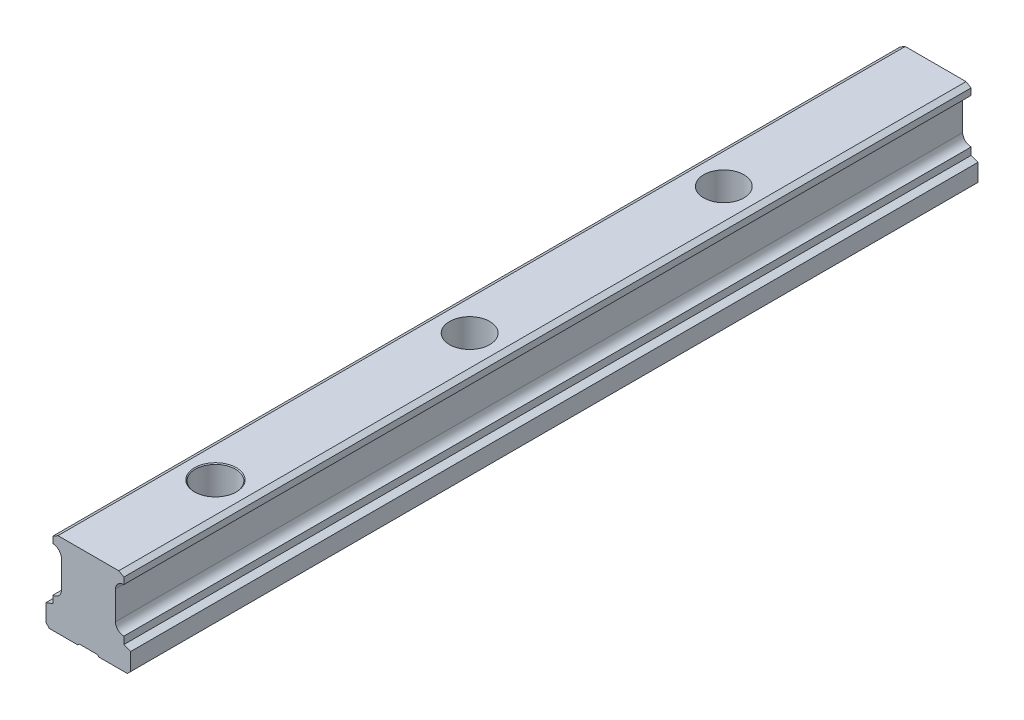
from build123d import *

# Parameters (mm, degrees)
BOSS_EXTRU_1_DEPTH      = 1980
ENL_V_MAT_EXTRU_1_DEPTH = 1981.194091497
ESQUISSE3_W             = 4.3
ESQUISSE3_H             = 0.35
ENL_V_MAT_EXTRU_2_DEPTH = 1980
ESQUISSE4_W             = 1.625
ESQUISSE4_H             = 14.5
ENL_V_MAT_EXTRU_3_DEPTH = 1981.194091497
ENL_V_MAT_EXTRU_4_DEPTH = 1981.194091497
D_POUILLE1_ANGLE        = 20
D_POUILLE2_ANGLE        = 20
D_POUILLE3_ANGLE        = 45
PER_AGE1_D              = 6
PER_AGE1_DEPTH          = 20
PER_AGE1_CBORE_D        = 9.5
PER_AGE1_CBORE_DEPTH    = 8.5
CHANFREIN1_SIZE         = 0.8
CHANFREIN2_SIZE         = 1.2
CHANFREIN2_SIZE2        = 0.692820323
CHANFREIN3_SIZE         = 0.2
CHANFREIN4_SIZE         = 0.692820323
CHANFREIN4_SIZE2        = 1.2
ENL_V_START             = -200
ESQUISSE12_W            = 78.153878041
ESQUISSE12_H            = 74.514600195
ENL_V_MAT_EXTRU_5_DEPTH = 1781.194091497


with BuildPart() as part:
    # Esquisse1 → Boss.-Extru.1 (new body)
    with BuildSketch(Plane(origin=(0, 0, 0), x_dir=(-1, 0, 0), z_dir=(0, 0, -1))):
        with BuildLine():
            Line((-19.2, 7.973691854), (-19.2, 0))
            Line((-19.2, 0), (0.8, 0))
            Line((0.8, 0), (0.8, 20))
            Line((0.8, 20), (-17.575, 20))
            Line((-17.575, 20), (-17.575, 17.767136655))
            ThreePointArc((-17.575, 17.767136655), (-16.197491801, 17.200016465), (-15.5625262, 15.852436102))
            Line((-15.5625262, 15.852436102), (-15.5625262, 9.147563898))
            ThreePointArc((-15.5625262, 9.147563898), (-16.984759825, 7.331984363), (-19.2, 7.973691854))
        make_face()
    extrude(amount=-BOSS_EXTRU_1_DEPTH)

    # Esquisse2 → Enlèv. mat.-Extru.1 (cut, through all)
    with BuildSketch(Plane.XY.offset(1980)):
        with BuildLine():
            Line((17.575, 7.232863345), (17.575, 4.908548369))
            Line((17.575, 4.908548369), (19.2, 4.908548369))
            Line((19.2, 4.908548369), (19.2, 7.973691854))
            ThreePointArc((19.2, 7.973691854), (18.471955551, 7.418025184), (17.575, 7.232863345))
        make_face()
    extrude(amount=-ENL_V_MAT_EXTRU_1_DEPTH, mode=Mode.SUBTRACT)

    # Esquisse3 → Enlèv. mat.-Extru.2 (cut)
    with BuildSketch(Plane.XY.offset(1980)):
        with Locations((9.2, 0.175)):
            Rectangle(ESQUISSE3_W, ESQUISSE3_H)
    extrude(amount=-ENL_V_MAT_EXTRU_2_DEPTH, mode=Mode.SUBTRACT)

    # Esquisse4 → Enlèv. mat.-Extru.3 (cut, through all)
    with BuildSketch(Plane.XY.offset(1980)):
        with Locations((0.0125, 12.75)):
            Rectangle(ESQUISSE4_W, ESQUISSE4_H)
    extrude(amount=-ENL_V_MAT_EXTRU_3_DEPTH, mode=Mode.SUBTRACT)

    # Esquisse5 → Enlèv. mat.-Extru.4 (cut, through all)
    with BuildSketch(Plane.XY.offset(1980)):
        with BuildLine():
            Line((0.825, 17.767136655), (0.825, 7.232863345))
            ThreePointArc((0.825, 7.232863345), (2.202508199, 7.799983535), (2.8374738, 9.147563898))
            Line((2.8374738, 9.147563898), (2.8374738, 15.852436102))
            ThreePointArc((2.8374738, 15.852436102), (2.202508199, 17.200016465), (0.825, 17.767136655))
        make_face()
    extrude(amount=-ENL_V_MAT_EXTRU_4_DEPTH, mode=Mode.SUBTRACT)

    # Dépouille1
    d_pouille1_faces = [part.faces().sort_by_distance(p)[0] for p in [
        (0.0125, 5.5, 990),
    ]]
    draft(d_pouille1_faces, Plane(origin=(0.825, 5.5, 0), x_dir=(0, -1, 0), z_dir=(-1, 0, 0)), D_POUILLE1_ANGLE)

    # Dépouille2
    d_pouille2_faces = [part.faces().sort_by_distance(p)[0] for p in [
        (18.3875, 4.908548369, 990),
    ]]
    draft(d_pouille2_faces, Plane(origin=(19.2, 7.973691854, 1980), x_dir=(0, 0, 1), z_dir=(1, 0, 0)), D_POUILLE2_ANGLE)

    # Dépouille3
    d_pouille3_faces = [part.faces().sort_by_distance(p)[0] for p in [
        (11.35, 0.175, 990),
        (7.05, 0.175, 990),
    ]]
    draft(d_pouille3_faces, Plane(origin=(11.35, 0.35, 0), x_dir=(0, 0, -1), z_dir=(0, -1, 0)), D_POUILLE3_ANGLE)

    # Perçage1
    with Locations(Plane(origin=(0, 20, 0), x_dir=(1, 0, 0), z_dir=(0, 1, 0))):
        with Locations((9.2, -30), (9.2, -90), (9.2, -150), (9.2, -210), (9.2, -270), (9.2, -330), (9.2, -390), (9.2, -450), (9.2, -510), (9.2, -570), (9.2, -630), (9.2, -690), (9.2, -750), (9.2, -810), (9.2, -870), (9.2, -930), (9.2, -990), (9.2, -1050), (9.2, -1110), (9.2, -1170), (9.2, -1230), (9.2, -1290), (9.2, -1350), (9.2, -1410), (9.2, -1470), (9.2, -1530), (9.2, -1590), (9.2, -1650), (9.2, -1710), (9.2, -1770), (9.2, -1830), (9.2, -1890), (9.2, -1950)):
            CounterBoreHole(PER_AGE1_D / 2, PER_AGE1_CBORE_D / 2, PER_AGE1_CBORE_DEPTH, depth=PER_AGE1_DEPTH)

    # Chanfrein1
    chanfrein1_edges = [part.edges().sort_by_distance(p)[0] for p in [
        (-0.8, 0, 990),
        (19.2, 0, 990),
    ]]
    chamfer(chanfrein1_edges, length=CHANFREIN1_SIZE)

    # Chanfrein2
    chanfrein2_edges = [part.edges().sort_by_distance(p)[0] for p in [
        (0.825, 20, 990),
    ]]
    chanfrein2_side = [part.faces().sort_by_distance(p)[0] for p in [
        (9.2, 20, 19.800708478),
    ]]
    chamfer(chanfrein2_edges, length=CHANFREIN2_SIZE, length2=CHANFREIN2_SIZE2, reference=chanfrein2_side[0])

    # Chanfrein3
    chanfrein3_edges = [part.edges().sort_by_distance(p)[0] for p in [
        (12.2, 0, 1950),
        (6.327718677, 0, 1949.133974596),
        (4.45, 20, 1950),
    ]]
    chamfer(chanfrein3_edges, length=CHANFREIN3_SIZE)

    # Chanfrein4
    chanfrein4_edges = [part.edges().sort_by_distance(p)[0] for p in [
        (17.575, 20, 990),
    ]]
    chanfrein4_side = [part.faces().sort_by_distance(p)[0] for p in [
        (17.575, 18.883568328, 990),
    ]]
    chamfer(chanfrein4_edges, length=CHANFREIN4_SIZE, length2=CHANFREIN4_SIZE2, reference=chanfrein4_side[0])

    # Esquisse12 → Enlèv. mat.-Extru.5 (cut, through all)
    with BuildSketch(Plane.XY.offset(1980).offset(ENL_V_START)):
        with Locations((15.863080013, 8.671326529)):
            Rectangle(ESQUISSE12_W, ESQUISSE12_H)
    extrude(amount=-ENL_V_MAT_EXTRU_5_DEPTH, mode=Mode.SUBTRACT)


solid = part.part
